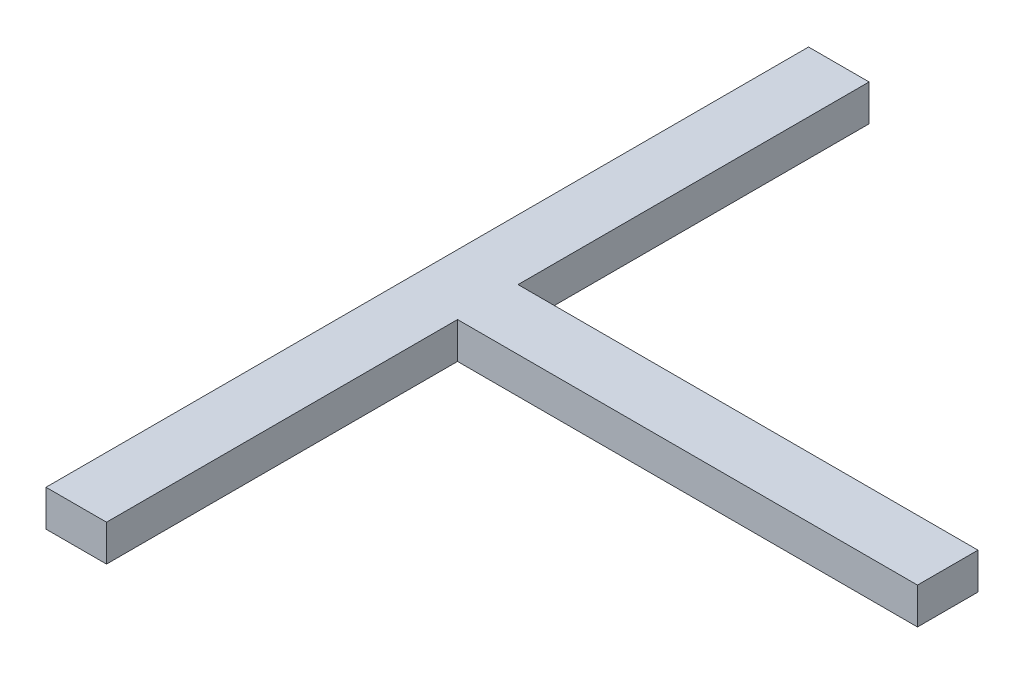
from build123d import *

# Parameters (mm, degrees)
BOSS_EXTRUDE1_DEPTH = 3


with BuildPart() as part:
    # Sketch1 → Boss-Extrude1 (new body)
    with BuildSketch(Plane(origin=(0, 0, 0), x_dir=(1, 0, 0), z_dir=(0, 1, 0))):
        Polygon((2.5, 31.5), (-2.5, 31.5), (-2.5, -31.5), (2.5, -31.5), (2.5, -2.5), (40.5, -2.5), (40.5, 2.5), (2.5, 2.5), align=None)
    extrude(amount=BOSS_EXTRUDE1_DEPTH)


solid = part.part
